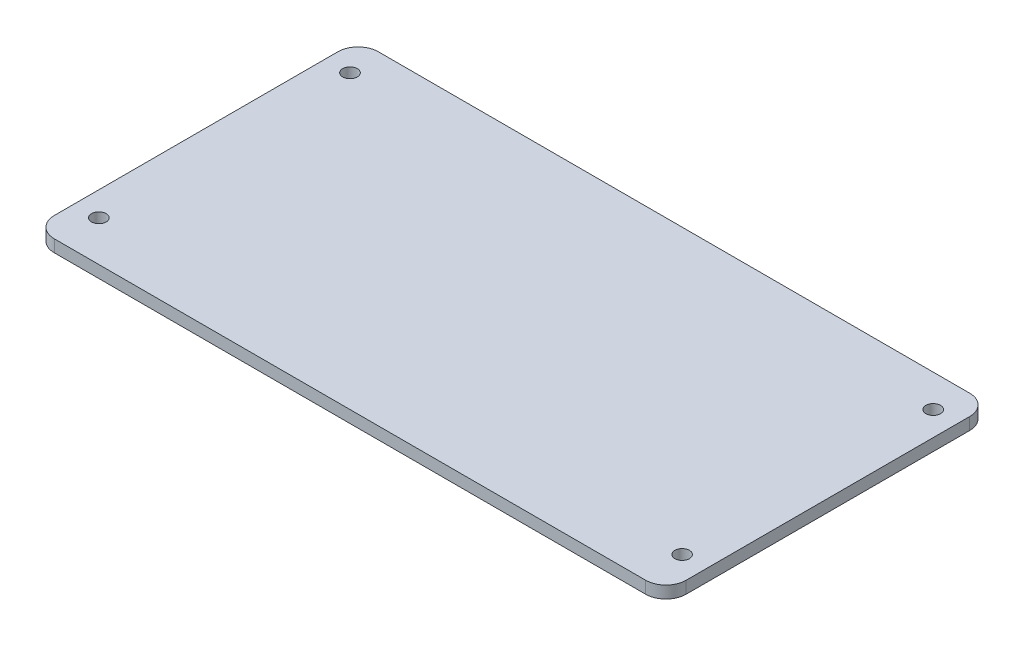
from build123d import *

# Parameters (mm, degrees)
SKETCH1_W           = 156
SKETCH1_H           = 80
SKETCH1_R           = 1.8
BOSS_EXTRUDE1_DEPTH = 3
FILLET1_R           = 5


with BuildPart() as part:
    # Sketch1 → Boss-Extrude1 (new body)
    with BuildSketch(Plane(origin=(0, 0, 0), x_dir=(1, 0, 0), z_dir=(0, 1, 0))):
        with Locations((-78, -40)):
            Rectangle(SKETCH1_W, SKETCH1_H)
        with Locations(Location((-150, -70, 0), (0, 0, 270))):
            Circle(SKETCH1_R, mode=Mode.SUBTRACT)
        with Locations(Location((-6, -70, 0), (0, 0, 270))):
            Circle(SKETCH1_R, mode=Mode.SUBTRACT)
        with Locations(Location((-6, -8, 0), (0, 0, 270))):
            Circle(SKETCH1_R, mode=Mode.SUBTRACT)
        with Locations(Location((-150, -8, 0), (0, 0, 270))):
            Circle(SKETCH1_R, mode=Mode.SUBTRACT)
    extrude(amount=BOSS_EXTRUDE1_DEPTH)

    # Fillet1
    fillet1_edges = [part.edges().sort_by_distance(p)[0] for p in [
        (0, 1.5, 80),
        (-156, 1.5, 80),
        (-156, 1.5, 0),
        (0, 1.5, 0),
    ]]
    fillet(fillet1_edges, radius=FILLET1_R)


solid = part.part
